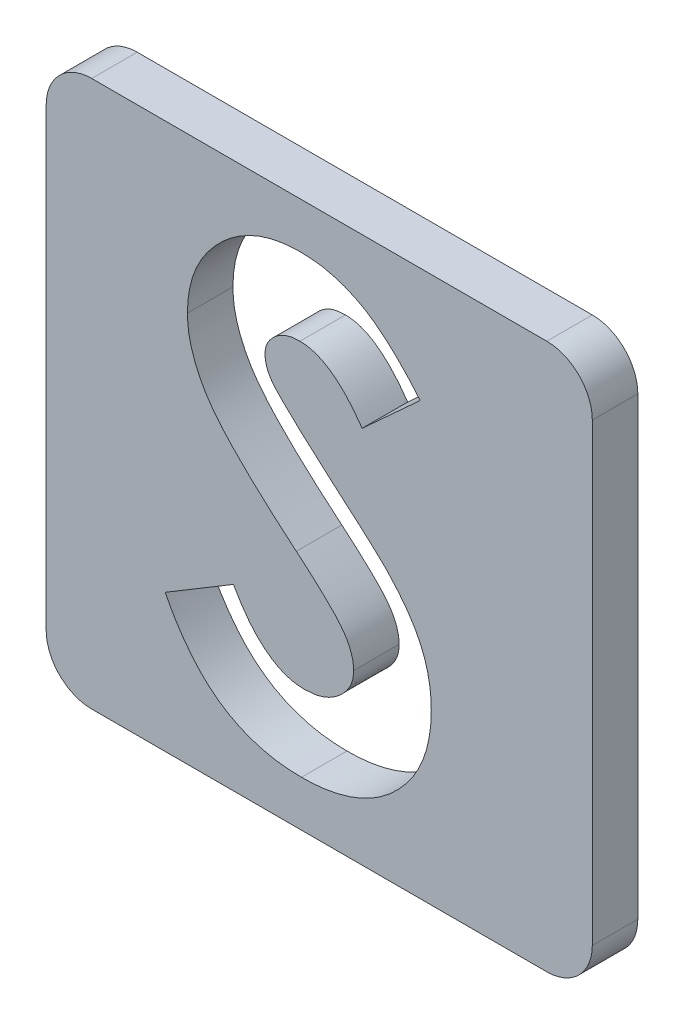
from build123d import *

# Parameters (mm, degrees)
BOSS_EXTRUDE1_DEPTH = 10
CUT_EXTRUDE32_DEPTH = 10


with BuildPart() as part:
    # Sketch1 → Boss-Extrude1 (new body)
    with BuildSketch(Plane.XY):
        with BuildLine():
            Line((-50, 60), (50, 60))
            ThreePointArc((50, 60), (57.071067812, 57.071067812), (60, 50))
            Line((60, 50), (60, -50))
            ThreePointArc((60, -50), (57.071067812, -57.071067812), (50, -60))
            Line((50, -60), (-50, -60))
            ThreePointArc((-50, -60), (-57.071067812, -57.071067812), (-60, -50))
            Line((-60, -50), (-60, 50))
            ThreePointArc((-60, 50), (-57.071067812, 57.071067812), (-50, 60))
        make_face()
    extrude(amount=BOSS_EXTRUDE1_DEPTH)

    # Sketch2 → Cut-Extrude32 (cut)
    with BuildSketch(Plane.XY.offset(10)):
        with BuildLine():
            Line((22.179487179, 34.806690705), (9.429086538, 23.141025641))
            add(Edge.make_bspline(
                [(9.429086538, 23.141025641), (8.882914048, 23.91145872), (7.834339031, 25.390582792), (6.134708299, 27.371164786), (4.442752271, 29.06074862), (2.742796004, 30.452275993), (1.019771731, 31.537292342), (-0.723329628, 32.305495903), (-2.476625945, 32.793850197), (-3.654570423, 32.854662056), (-4.234775641, 32.884615385)],
                knots=[0, 0, 0, 0, 1.299362458, 2.494594718, 3.587462134, 4.587049575, 5.512617175, 6.380583204, 7.202344345, 8, 8, 8, 8], degree=3))
            add(Edge.make_bspline(
                [(-4.234775641, 32.884615385), (-4.775974426, 32.865635582), (-5.820887089, 32.828990568), (-7.31048761, 32.464741869), (-8.632976167, 31.836102106), (-9.787062069, 31.01410273), (-10.701268375, 30.023784052), (-11.431191215, 28.98519439), (-11.842199109, 27.838826287), (-11.896295835, 27.05145443), (-11.923076923, 26.661658654)],
                knots=[0, 0, 0, 0, 1.185010067, 2.2879431, 3.333075148, 4.379039566, 5.372662701, 6.27520591, 7.14612461, 8, 8, 8, 8], degree=3))
            add(Edge.make_bspline(
                [(-11.923076923, 26.661658654), (-11.906294573, 26.266241849), (-11.872497251, 25.469927355), (-11.546061132, 24.302829291), (-11.054028691, 23.162438622), (-10.583871606, 22.468228557), (-10.343549679, 22.11338141)],
                knots=[0, 0, 0, 0, 0.967525499, 1.948461899, 2.951351359, 4, 4, 4, 4], degree=3))
            add(Edge.make_bspline(
                [(-10.343549679, 22.11338141), (-10.125071051, 21.837562436), (-9.622162103, 21.202663585), (-8.663217741, 20.197082772), (-7.458985017, 18.965158257), (-5.96312252, 17.549252313), (-4.237727617, 15.898443424), (-2.202826025, 14.077625518), (0.083008913, 12.030409979), (1.707727428, 10.604803211), (2.559094551, 9.857772436)],
                knots=[0, 0, 0, 0, 0.473873513, 1.090794244, 1.870441696, 2.795289791, 3.865433203, 5.087734844, 6.473946851, 8, 8, 8, 8], degree=3))
            add(Edge.make_bspline(
                [(2.559094551, 9.857772436), (3.358225064, 9.166165286), (4.874808752, 7.853638601), (7.032606174, 5.990717711), (8.92895073, 4.31469321), (10.591467834, 2.85071864), (11.994955347, 1.583433555), (13.145313536, 0.506780349), (14.056592075, -0.358280522), (14.574600568, -0.880777815), (14.795673077, -1.103766026)],
                knots=[0, 0, 0, 0, 1.543621617, 2.929473131, 4.163658386, 5.240097082, 6.164993805, 6.925417477, 7.541396219, 8, 8, 8, 8], degree=3))
            add(Edge.make_bspline(
                [(14.795673077, -1.103766026), (15.634376084, -2.011422303), (17.246657803, -3.756256423), (19.342055672, -6.460200571), (21.066635897, -9.099801404), (22.400803862, -11.724727295), (23.40842117, -14.372850698), (24.118804721, -17.109116699), (24.544258155, -19.96211756), (24.59149342, -21.908942364), (24.615384615, -22.893629808)],
                knots=[0, 0, 0, 0, 1.206664779, 2.319633467, 3.337109185, 4.282041471, 5.190008762, 6.099243693, 7.03861361, 8, 8, 8, 8], degree=3))
            add(Edge.make_bspline(
                [(24.615384615, -22.893629808), (24.598379474, -23.853086961), (24.565014754, -25.735577605), (24.156360918, -28.490322254), (23.573644532, -31.126732441), (22.672662774, -33.616120296), (21.574551543, -35.999348361), (20.197910517, -38.239293521), (18.581234396, -40.358624937), (16.728275333, -42.319456968), (14.67868258, -44.098776126), (12.480299564, -45.682768067), (10.111629387, -46.990555178), (7.592909595, -48.06742458), (4.925488401, -48.896843793), (2.112543508, -49.509861892), (-0.850227675, -49.877785692), (-2.876213304, -49.91624776), (-3.911258013, -49.935897436)],
                knots=[0, 0, 0, 0, 1.043214005, 2.046824704, 3.02475056, 3.976699089, 4.921714032, 5.875962561, 6.831408892, 7.817874052, 8.806269674, 9.781291748, 10.760897367, 11.74438705, 12.757449933, 13.795994037, 14.874007457, 16, 16, 16, 16], degree=3))
            add(Edge.make_bspline(
                [(-3.911258013, -49.935897436), (-4.723759295, -49.921483122), (-6.332977804, -49.892934513), (-8.704722601, -49.659858889), (-10.994910313, -49.283699628), (-13.200961249, -48.74455104), (-15.332814058, -48.061376655), (-17.390556291, -47.226905315), (-19.359982672, -46.228203026), (-21.255994813, -45.085807078), (-23.069375756, -43.759334902), (-24.82305499, -42.275905787), (-26.499613308, -40.612703931), (-28.107102878, -38.773662739), (-29.635238535, -36.753574491), (-31.134041642, -34.580572653), (-32.53690088, -32.214329262), (-33.403509434, -30.554390381), (-33.846153846, -29.706530449)],
                knots=[0, 0, 0, 0, 1.016823716, 2.013894106, 2.979844003, 3.91962641, 4.853723003, 5.779685073, 6.695824784, 7.614987388, 8.547259901, 9.504950863, 10.487499108, 11.500346958, 12.559593716, 13.656357062, 14.802919212, 16, 16, 16, 16], degree=3))
            Line((-33.846153846, -29.706530449), (-18.850160256, -20.705128205))
            add(Edge.make_bspline(
                [(-18.850160256, -20.705128205), (-18.296478254, -21.667560008), (-17.235022533, -23.512624029), (-15.436286582, -25.991701389), (-13.593573429, -28.114620785), (-11.664281196, -29.843859481), (-9.671869355, -31.202539621), (-7.606714094, -32.173546708), (-5.467364474, -32.774598996), (-4.010136703, -32.848001363), (-3.283253205, -32.884615385)],
                knots=[0, 0, 0, 0, 1.283663364, 2.460892379, 3.537111102, 4.529833553, 5.449777664, 6.316464042, 7.160231139, 8, 8, 8, 8], degree=3))
            add(Edge.make_bspline(
                [(-3.283253205, -32.884615385), (-2.543908622, -32.854714389), (-1.109472453, -32.796702103), (0.938001622, -32.26086011), (2.81520338, -31.41954887), (4.437842715, -30.219113746), (5.811791397, -28.83362916), (6.825844389, -27.292214207), (7.462879318, -25.624440438), (7.530229355, -24.465895073), (7.564102564, -23.883213141)],
                knots=[0, 0, 0, 0, 1.13588714, 2.203786484, 3.234766741, 4.283437687, 5.291419208, 6.222934724, 7.106237994, 8, 8, 8, 8], degree=3))
            add(Edge.make_bspline(
                [(7.564102564, -23.883213141), (7.532822042, -23.341122423), (7.469278655, -22.239917025), (7.001237654, -20.602601675), (6.26954681, -18.966030942), (5.403904944, -17.62367135), (4.523005953, -16.499750052), (3.68066783, -15.525923088), (2.654922822, -14.450014779), (1.448371765, -13.270671713), (0.076956347, -11.977511836), (-1.460478671, -10.570661777), (-3.181538547, -9.062514205), (-4.397987064, -8.035178979), (-5.034054487, -7.497996795)],
                knots=[0, 0, 0, 0, 0.916159276, 1.861089862, 2.860218735, 3.940849679, 4.552606315, 5.27541173, 6.11797699, 7.06649574, 8.129236253, 9.306560635, 10.591630461, 12, 12, 12, 12], degree=3))
            add(Edge.make_bspline(
                [(-5.034054487, -7.497996795), (-6.243243975, -6.474906536), (-8.564044597, -4.511286663), (-11.84363032, -1.611081927), (-14.798830707, 1.099425143), (-17.404121473, 3.653742339), (-19.692698053, 6.004697341), (-21.649061212, 8.171385505), (-23.251719411, 10.170519868), (-24.938171589, 12.538360741), (-26.540638342, 15.423737543), (-27.925624358, 18.895180326), (-28.824144829, 22.366182634), (-28.924811551, 24.696422404), (-28.974358974, 25.843349359)],
                knots=[0, 0, 0, 0, 1.345494975, 2.582412109, 3.71882943, 4.751509156, 5.681369928, 6.505683931, 7.230279997, 7.856715994, 8.973648664, 10.023341002, 11.027102913, 12, 12, 12, 12], degree=3))
            add(Edge.make_bspline(
                [(-28.974358974, 25.843349359), (-28.953752267, 26.656688395), (-28.91315484, 28.259053664), (-28.551019527, 30.61509832), (-28.009794504, 32.888483451), (-27.223780391, 35.070914712), (-26.203628979, 37.159658519), (-24.964694716, 39.164940152), (-23.487739299, 41.068303453), (-21.823310254, 42.868486626), (-19.989535587, 44.513649186), (-18.029914316, 45.965669991), (-15.955538071, 47.192067876), (-13.779096835, 48.209453974), (-11.487104107, 48.988198402), (-9.096444894, 49.540211269), (-6.60369023, 49.868530918), (-4.908172315, 49.913162165), (-4.044471154, 49.935897436)],
                knots=[0, 0, 0, 0, 1.010766082, 1.991317756, 2.957454644, 3.913069143, 4.869106762, 5.843196583, 6.838735724, 7.860187025, 8.887984031, 9.89767229, 10.887916223, 11.879572884, 12.879850636, 13.892031539, 14.926195476, 16, 16, 16, 16], degree=3))
            add(Edge.make_bspline(
                [(-4.044471154, 49.935897436), (-2.925157197, 49.894950547), (-0.695364756, 49.813379988), (2.601447679, 49.175524879), (5.821636228, 48.17243053), (8.416524509, 46.962307558), (10.481228679, 45.790060863), (12.063631555, 44.71080377), (13.673811657, 43.474456765), (15.324754087, 42.07712379), (16.98578178, 40.492477259), (18.704125696, 38.758240928), (20.456371299, 36.85942694), (21.595053116, 35.502923032), (22.179487179, 34.806690705)],
                knots=[0, 0, 0, 0, 1.282922637, 2.555718331, 3.837320111, 5.142675274, 5.830281639, 6.55870424, 7.337177975, 8.157850921, 9.037902056, 9.96903443, 10.957596896, 12, 12, 12, 12], degree=3))
        make_face()
    extrude(amount=-CUT_EXTRUDE32_DEPTH, mode=Mode.SUBTRACT)


solid = part.part
